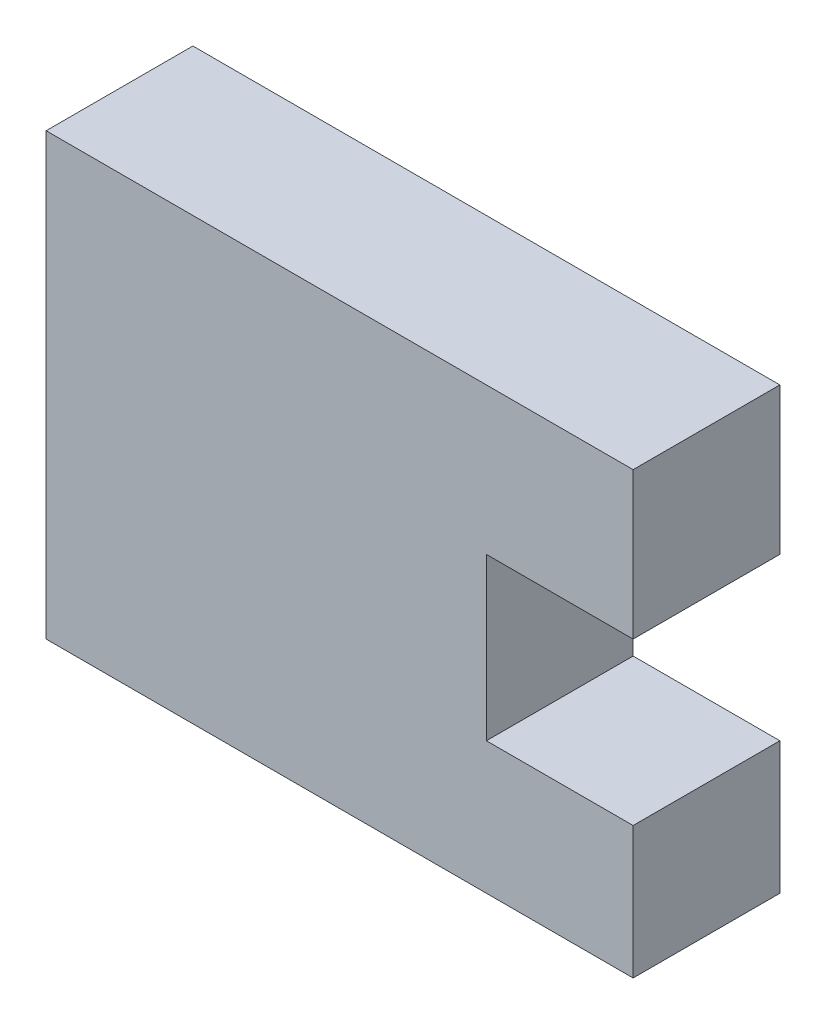
from build123d import *

# Parameters (mm, degrees)
BOSS_EXTRUDE1_DEPTH = 20


with BuildPart() as part:
    # Sketch1 → Boss-Extrude1 (new body)
    with BuildSketch(Plane.XY):
        Polygon((80, 40), (60, 40), (60, 18), (80, 18), (80, 0), (0, 0), (0, 60), (80, 60), align=None)
    extrude(amount=BOSS_EXTRUDE1_DEPTH)


solid = part.part
